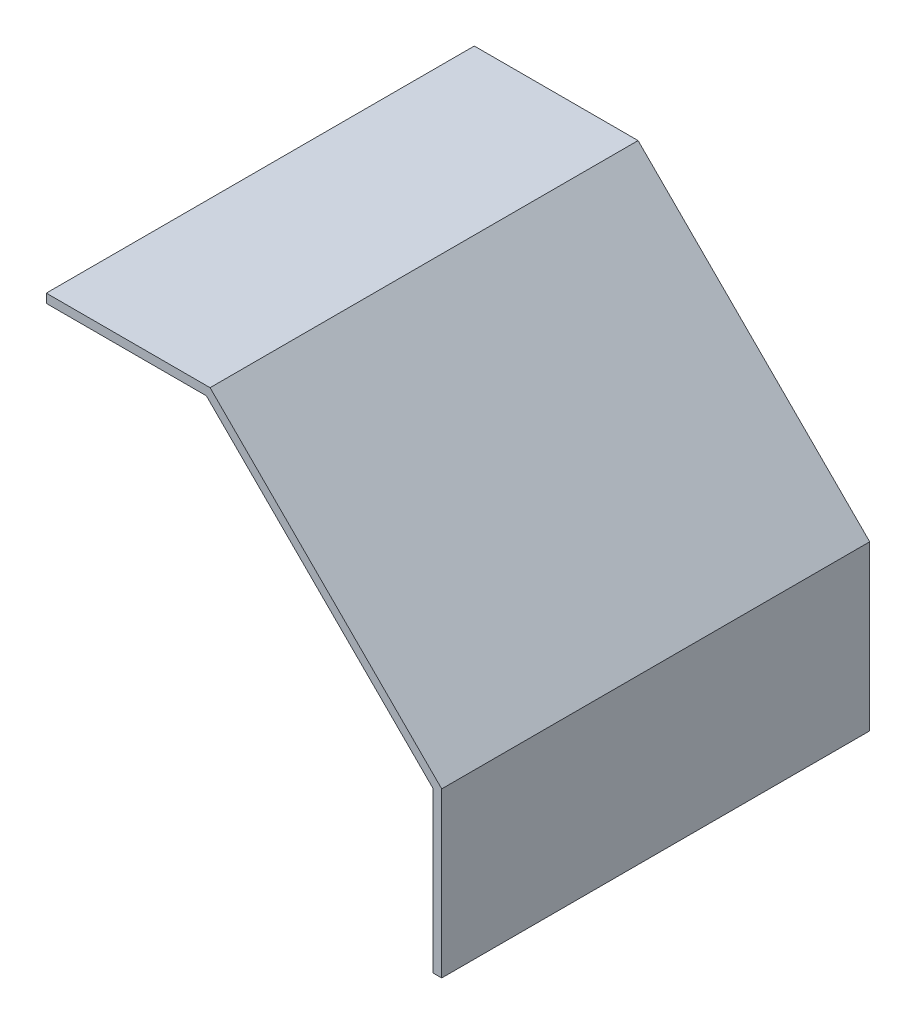
from build123d import *

# Parameters (mm, degrees)
BOSS_EXTRUDE1_DEPTH = 304.8


with BuildPart() as part:
    # Sketch1 → Boss-Extrude1 (new body)
    with BuildSketch(Plane.XY):
        Polygon((0, 281.598481509), (116.641910185, 281.598481509), (281.598481509, 116.641910185), (281.598481509, 0), (275.248481509, 0), (275.248481509, 114.011654064), (114.011654064, 275.248481509), (0, 275.248481509), align=None)
    extrude(amount=BOSS_EXTRUDE1_DEPTH)


solid = part.part
